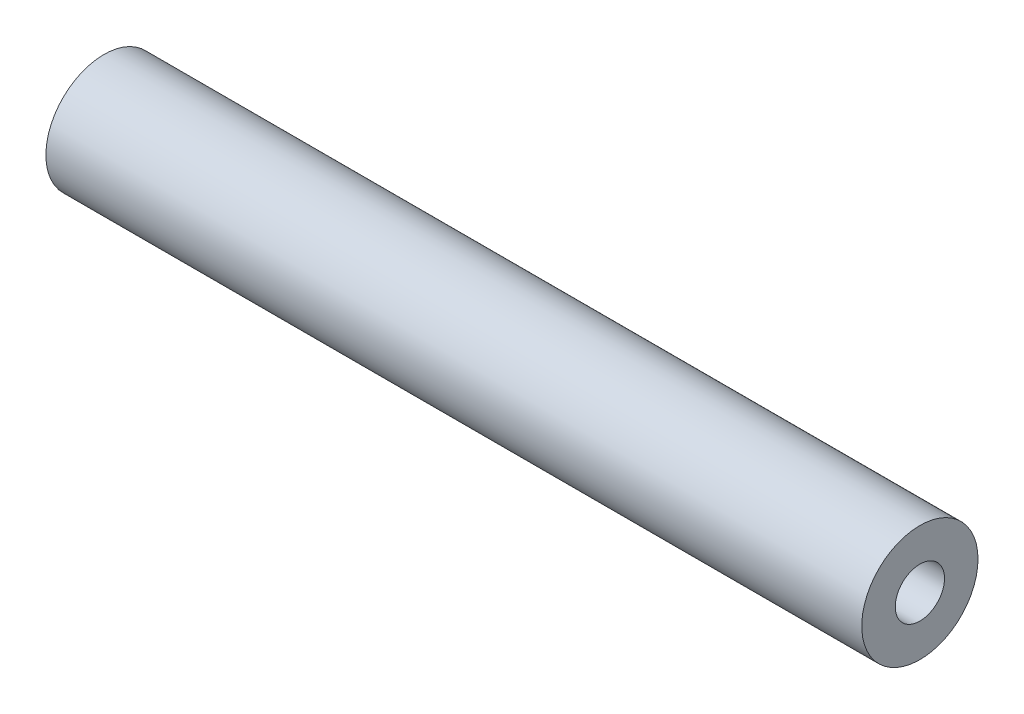
from build123d import *

# Parameters (mm, degrees)
SKETCH1_R           = 4.7625
SKETCH1_R_2         = 2.0193
BOSS_EXTRUDE1_DEPTH = 66.853999896


with BuildPart() as part:
    # Sketch1 → Boss-Extrude1 (new body)
    with BuildSketch(Plane(origin=(0, 0, 0), x_dir=(0, 0, -1), z_dir=(1, 0, 0))):
        Circle(SKETCH1_R)
        Circle(SKETCH1_R_2, mode=Mode.SUBTRACT)
    extrude(amount=BOSS_EXTRUDE1_DEPTH)


solid = part.part
